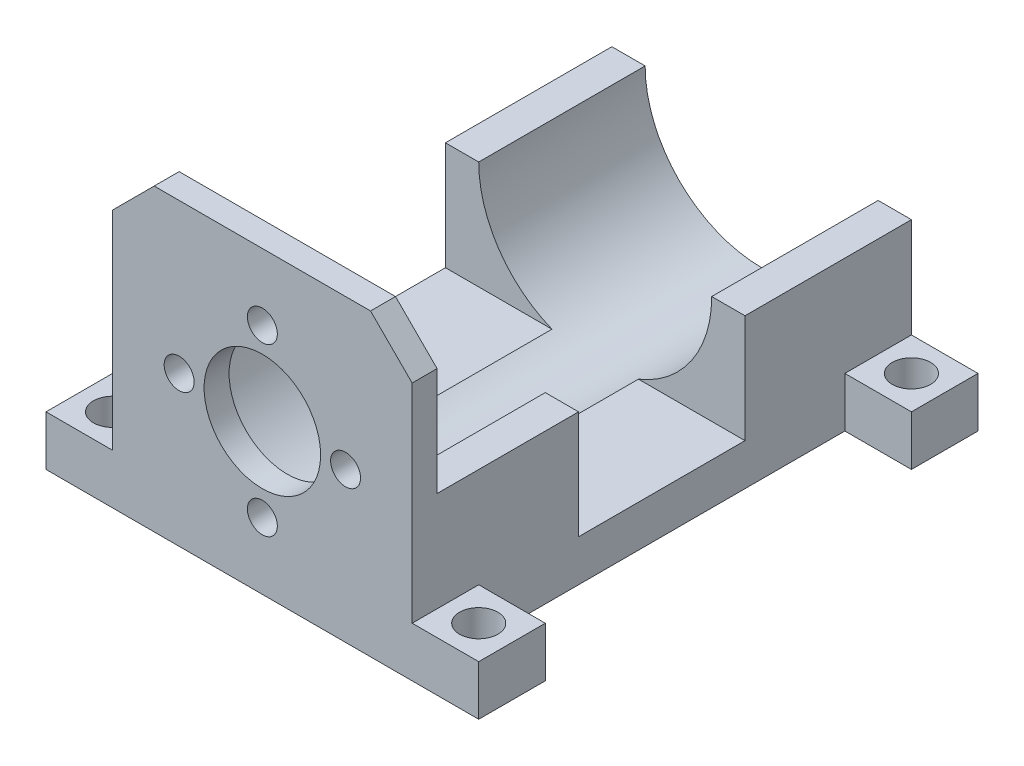
from build123d import *

# Parameters (mm, degrees)
BOSS_EXTRU_1_DEPTH      = 60
ESQUISSE1_3_R           = 1.8
ESQUISSE1_3_R_2         = 7
BOSS_EXTRU_2_DEPTH      = 3
ENL_V_MAT_EXTRU_2_DEPTH = 50
ESQUISSE2_W             = 8
ESQUISSE2_H             = 8
ESQUISSE2_R             = 2.3
BOSS_EXTRU_4_DEPTH      = 6


with BuildPart() as part:
    # Esquisse1 → Boss.-Extru.1 (new body)
    with BuildSketch(Plane.XY):
        with BuildLine():
            ThreePointArc((18, 0), (12.727922061, -12.727922061), (0, -18))
            Line((0, -18), (18, -18))
            Line((18, -18), (18, 0))
        make_face()
        with BuildLine():
            ThreePointArc((0, -18), (-12.727922061, -12.727922061), (-18, 0))
            Line((-18, 0), (-18, -18))
            Line((-18, -18), (0, -18))
        make_face()
        with BuildLine():
            Line((-14, 0), (-18, 0))
            ThreePointArc((-18, 0), (-12.727922061, -12.727922061), (0, -18))
            ThreePointArc((0, -18), (12.727922061, -12.727922061), (18, 0))
            Line((18, 0), (14, 0))
            ThreePointArc((14, 0), (0, -14), (-14, 0))
        make_face()
    extrude(amount=-BOSS_EXTRU_1_DEPTH)

    # Esquisse1<3> → Boss.-Extru.2 (add)
    with BuildSketch(Plane.XY):
        with BuildLine():
            Line((-13, 18), (-18, 13))
            Line((-18, 13), (-18, 0))
            Line((-18, 0), (-14, 0))
            ThreePointArc((-14, 0), (0, -14), (14, 0))
            Line((14, 0), (18, 0))
            Line((18, 0), (18, 13))
            Line((18, 13), (13, 18))
            Line((13, 18), (-13, 18))
        make_face()
        with Locations((0, 10)):
            Circle(ESQUISSE1_3_R, mode=Mode.SUBTRACT)
        with Locations((0, -10)):
            Circle(ESQUISSE1_3_R, mode=Mode.SUBTRACT)
        with Locations((-10, 0)):
            Circle(ESQUISSE1_3_R, mode=Mode.SUBTRACT)
        Circle(ESQUISSE1_3_R_2, mode=Mode.SUBTRACT)
        with Locations((10, 0)):
            Circle(ESQUISSE1_3_R, mode=Mode.SUBTRACT)
    extrude(amount=-BOSS_EXTRU_2_DEPTH)

    # Esquisse3 → Enlèv. mat.-Extru.2 (cut)
    with BuildSketch(Plane.ZY.offset(18)):
        Polygon((-30, 0), (-20, 0), (-20, -13), (-40, -13), (-40, 0), align=None)
    extrude(amount=-ENL_V_MAT_EXTRU_2_DEPTH, mode=Mode.SUBTRACT)

    # Esquisse2 → Boss.-Extru.4 (add)
    # profile 1 of 4: a face of its own
    with BuildSketch(Plane.XZ.offset(18)):
        with Locations((22, -56)):
            Rectangle(ESQUISSE2_W, ESQUISSE2_H)
        with Locations(Location((22, -56, 0), (0, 0, 270))):
            Circle(ESQUISSE2_R, mode=Mode.SUBTRACT)
    # profile 2 of 4: a face of its own
    with BuildSketch(Plane.XZ.offset(18)):
        with Locations((-22, -56)):
            Rectangle(ESQUISSE2_W, ESQUISSE2_H)
        with Locations(Location((-22, -56, 0), (0, 0, 270))):
            Circle(ESQUISSE2_R, mode=Mode.SUBTRACT)
    # profile 3 of 4: a face of its own
    with BuildSketch(Plane.XZ.offset(18)):
        with Locations((-22, -4)):
            Rectangle(ESQUISSE2_W, ESQUISSE2_H)
        with Locations(Location((-22, -4, 0), (0, 0, 270))):
            Circle(ESQUISSE2_R, mode=Mode.SUBTRACT)
    # profile 4 of 4: a face of its own
    with BuildSketch(Plane.XZ.offset(18)):
        with Locations((22, -4)):
            Rectangle(ESQUISSE2_W, ESQUISSE2_H)
        with Locations(Location((22, -4, 0), (0, 0, 270))):
            Circle(ESQUISSE2_R, mode=Mode.SUBTRACT)
    extrude(amount=-BOSS_EXTRU_4_DEPTH)


solid = part.part
